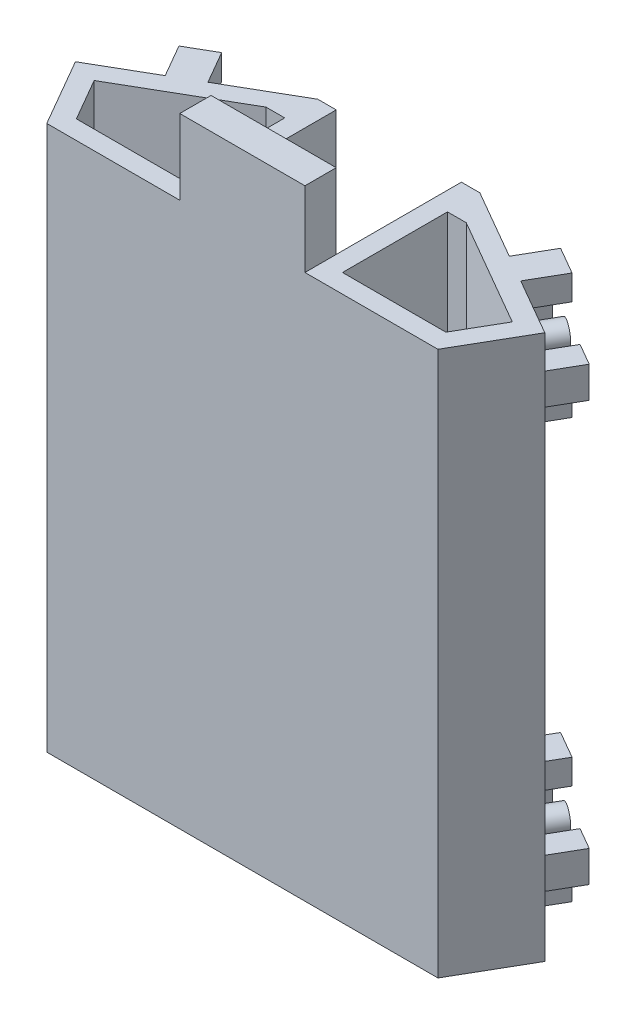
from build123d import *

# Parameters (mm, degrees)
BOSS_EXTRU_1_DEPTH          = 87
ENL_V_MAT_EXTRU_1_REACH     = 99.981
BOSS_EXTRU_2_DEPTH          = 87
ESQUISSE3_R                 = 1.9
ESQUISSE3_W                 = 5
ESQUISSE3_H                 = 4
ESQUISSE3_W_2               = 4
ESQUISSE3_H_2               = 5
BOSS_EXTRU_3_DEPTH          = 6
SYM_TRIE3_COPY_1_SKETCH_R   = 1.9
SYM_TRIE3_COPY_1_SKETCH_W   = 5
SYM_TRIE3_COPY_1_SKETCH_H   = 4
SYM_TRIE3_COPY_1_SKETCH_W_2 = 4
SYM_TRIE3_COPY_1_SKETCH_H_2 = 5
SYM_TRIE3_COPY_1_DEPTH      = 6
ESQUISSE5_W                 = 20
ESQUISSE5_H                 = 5
BOSS_EXTRU_4_DEPTH          = 12


with BuildPart() as part:
    # Esquisse1 → Boss.-Extru.1 (new body)
    with BuildSketch(Plane(origin=(0, 0, 0), x_dir=(1, 0, 0), z_dir=(0, 1, 0))):
        Polygon((-31.25, 0), (31.25, 0), (37.5, 10.825317547), (12.948729811, 25), (10, 25), (10, 5), (-10, 5), (-10, 25), (-12.948729811, 25), (-37.5, 10.825317547), align=None)
    extrude(amount=BOSS_EXTRU_1_DEPTH)

    # Esquisse2 → Enlèv. mat.-Extru.1 (cut, up to next)
    with BuildSketch(Plane(origin=(0, 87, 0), x_dir=(1, 0, 0), z_dir=(0, 1, 0)), mode=Mode.PRIVATE) as enl_v_mat_extru_1_sk1:
        Polygon((-36, 8.227241336), (-16, 19.77424672), (-13, 19.77424672), (-13, 0), (-31.25, 0), align=None)
    enl_v_mat_extru_1_tool1 = extrude(enl_v_mat_extru_1_sk1.sketch, amount=-ENL_V_MAT_EXTRU_1_REACH, mode=Mode.PRIVATE) & part.part
    enl_v_mat_extru_1 = enl_v_mat_extru_1_tool1.solids().sort_by_distance((-22.148909, 87, -8.14347))[0]
    add(enl_v_mat_extru_1, mode=Mode.SUBTRACT)

    # Symétrie1: Enlèv. mat.-Extru.1 across plane
    add(enl_v_mat_extru_1.mirror(Plane(origin=(0, 0, 0), x_dir=(0, 0, 1), z_dir=(1, 0, 0))), mode=Mode.SUBTRACT)

    # Esquisse4 → Boss.-Extru.2 (add)
    with BuildSketch(Plane(origin=(0, 0, 0), x_dir=(1, 0, 0), z_dir=(0, 1, 0))):
        Polygon((-37.5, 10.825317547), (-31.25, 0), (31.25, 0), (37.5, 10.825317547), (34.901923789, 12.325317547), (29.517949192, 3), (-29.517949192, 3), (-34.901923789, 12.325317547), align=None)
    extrude(amount=BOSS_EXTRU_2_DEPTH)

    # Esquisse3 → Boss.-Extru.3 (add)
    with BuildSketch(Plane(origin=(-14.0625, 0, -24.356964481), x_dir=(0.8660254037844396, 0, -0.4999999999999984), z_dir=(0.49999999999999833, 0, 0.8660254037844395))):
        with Locations((-14.063293868, 77)):
            Circle(ESQUISSE3_R)
        with Locations((-14.063293868, 85)):
            Rectangle(ESQUISSE3_W, ESQUISSE3_H)
        with Locations((-22.063293868, 77)):
            Rectangle(ESQUISSE3_W_2, ESQUISSE3_H_2)
        with Locations((-6.063293868, 77)):
            Rectangle(ESQUISSE3_W_2, ESQUISSE3_H_2)
        with Locations((-14.063293868, 69)):
            Rectangle(ESQUISSE3_W, ESQUISSE3_H)
    boss_extru_3 = extrude(amount=-BOSS_EXTRU_3_DEPTH)

    # Symétrie2: Boss.-Extru.3 across plane
    add(boss_extru_3.mirror(Plane.ZX.offset(43.5)))

    # Symétrie3: Boss.-Extru.3 across plane
    add(boss_extru_3.mirror(Plane(origin=(0, 0, 0), x_dir=(0, 0, 1), z_dir=(1, 0, 0))))

    # Symétrie3 copy 1 sketch → Symétrie3 copy 1 (add)
    with BuildSketch(Plane(origin=(14.0625, 87, -24.356964481), x_dir=(-0.8660254037844396, 0, -0.4999999999999984), z_dir=(-0.49999999999999833, 0, 0.8660254037844395))):
        with Locations((-14.063293868, 77)):
            Circle(SYM_TRIE3_COPY_1_SKETCH_R)
        with Locations((-14.063293868, 85)):
            Rectangle(SYM_TRIE3_COPY_1_SKETCH_W, SYM_TRIE3_COPY_1_SKETCH_H)
        with Locations((-22.063293868, 77)):
            Rectangle(SYM_TRIE3_COPY_1_SKETCH_W_2, SYM_TRIE3_COPY_1_SKETCH_H_2)
        with Locations((-6.063293868, 77)):
            Rectangle(SYM_TRIE3_COPY_1_SKETCH_W_2, SYM_TRIE3_COPY_1_SKETCH_H_2)
        with Locations((-14.063293868, 69)):
            Rectangle(SYM_TRIE3_COPY_1_SKETCH_W, SYM_TRIE3_COPY_1_SKETCH_H)
    extrude(amount=-SYM_TRIE3_COPY_1_DEPTH)

    # Esquisse5 → Boss.-Extru.4 (add)
    with BuildSketch(Plane(origin=(0, 87, 0), x_dir=(1, 0, 0), z_dir=(0, 1, 0))):
        with Locations((0, 2.5)):
            Rectangle(ESQUISSE5_W, ESQUISSE5_H)
    extrude(amount=BOSS_EXTRU_4_DEPTH)


solid = part.part
